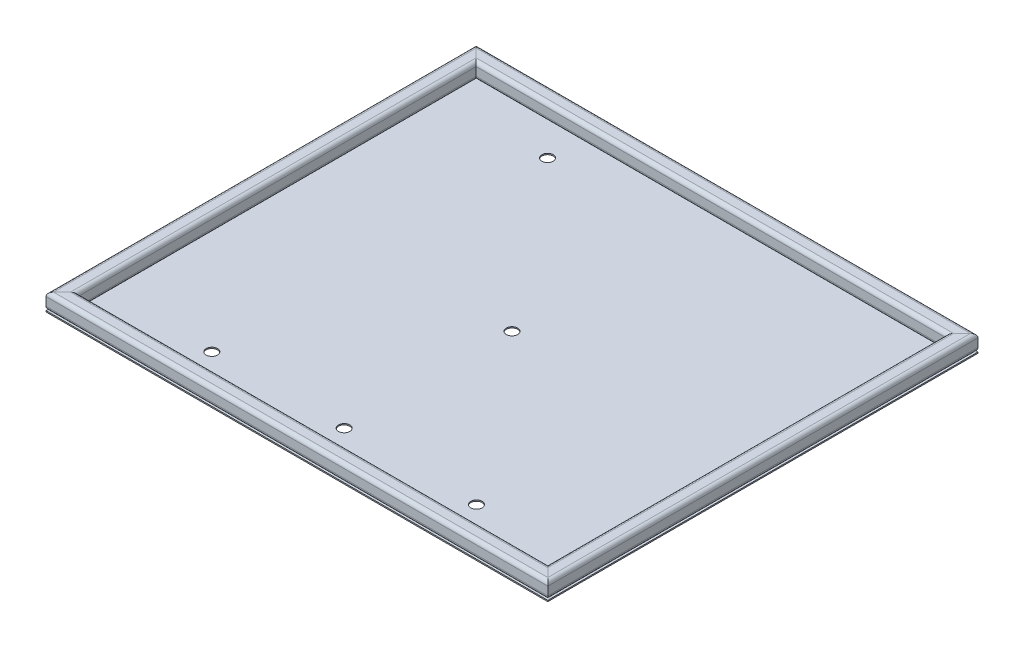
from build123d import *

# Parameters (mm, degrees)
TUBO_CUADRADO_2_X_2_X_0_25_1_DEPTH      = 719.721024484
TUBO_CUADRADO_2_X_2_X_0_25_1_DEPTH_BACK = 36.921024484
TUBO_CUADRADO_2_X_2_X_0_25_1_2_DEPTH    = 870.242048969
TUBO_CUADRADO_2_X_2_X_0_25_1_3_DEPTH    = 756.642048969
TUBO_CUADRADO_2_X_2_X_0_25_1_4_DEPTH    = 870.242048969
CROQUIS3_W                              = 796.4
CROQUIS3_H                              = 682.8
SALIENTE_EXTRUIR1_DEPTH                 = 1.9
CROQUIS6_R                              = 9
CORTAR_EXTRUIR2_DEPTH                   = 10


with BuildPart() as part:
    # Sketch1 → Tubo cuadrado 2 X 2 X 0.25(1) (new, two sides: drawn at the far end of the back side and taken through both)
    with BuildSketch(Plane(origin=(-385.5, 12.7, -341.4), x_dir=(1, 0, 0), z_dir=(0, 0, 1)).offset(-TUBO_CUADRADO_2_X_2_X_0_25_1_DEPTH_BACK)):
        with BuildLine():
            Line((-6.7, -12.7), (6.7, -12.7))
            ThreePointArc((6.7, -12.7), (10.942640687, -10.942640687), (12.7, -6.7))
            Line((12.7, -6.7), (12.7, 6.7))
            ThreePointArc((12.7, 6.7), (10.942640687, 10.942640687), (6.7, 12.7))
            Line((6.7, 12.7), (-6.7, 12.7))
            ThreePointArc((-6.7, 12.7), (-10.942640687, 10.942640687), (-12.7, 6.7))
            Line((-12.7, 6.7), (-12.7, -6.7))
            ThreePointArc((-12.7, -6.7), (-10.942640687, -10.942640687), (-6.7, -12.7))
        make_face()
        with BuildLine():
            Line((-6.7, -9.7), (6.7, -9.7))
            ThreePointArc((6.7, -9.7), (8.821320344, -8.821320344), (9.7, -6.7))
            Line((9.7, -6.7), (9.7, 6.7))
            ThreePointArc((9.7, 6.7), (8.821320344, 8.821320344), (6.7, 9.7))
            Line((6.7, 9.7), (-6.7, 9.7))
            ThreePointArc((-6.7, 9.7), (-8.821320344, 8.821320344), (-9.7, 6.7))
            Line((-9.7, 6.7), (-9.7, -6.7))
            ThreePointArc((-9.7, -6.7), (-8.821320344, -8.821320344), (-6.7, -9.7))
        make_face(mode=Mode.SUBTRACT)
    extrude(amount=TUBO_CUADRADO_2_X_2_X_0_25_1_DEPTH + TUBO_CUADRADO_2_X_2_X_0_25_1_DEPTH_BACK)

    # Tubo cuadrado 2 X 2 X 0.25(1) mitre 1
    split(bisect_by=Plane(origin=(-398.2, 0, -341.4), x_dir=(0, -1, 0), z_dir=(-0.707106781, 0, 0.707106781)), keep=Keep.TOP)

    # Tubo cuadrado 2 X 2 X 0.25(1) mitre 2
    split(bisect_by=Plane(origin=(-398.2, 0, 341.4), x_dir=(0, -1, 0), z_dir=(-0.707106781, 0, -0.707106781)), keep=Keep.TOP)


with BuildPart() as body_2:
    # Sketch1 on segment 2 (carried to segment 2) → Tubo cuadrado 2 X 2 X 0.25_1 2 (new body)
    with BuildSketch(Plane(origin=(-435.121024484, 12.7, 328.7), x_dir=(0, 0, -1), z_dir=(1, 0, 0))):
        with BuildLine():
            Line((-6.7, -12.7), (6.7, -12.7))
            ThreePointArc((6.7, -12.7), (10.942640687, -10.942640687), (12.7, -6.7))
            Line((12.7, -6.7), (12.7, 6.7))
            ThreePointArc((12.7, 6.7), (10.942640687, 10.942640687), (6.7, 12.7))
            Line((6.7, 12.7), (-6.7, 12.7))
            ThreePointArc((-6.7, 12.7), (-10.942640687, 10.942640687), (-12.7, 6.7))
            Line((-12.7, 6.7), (-12.7, -6.7))
            ThreePointArc((-12.7, -6.7), (-10.942640687, -10.942640687), (-6.7, -12.7))
        make_face()
        with BuildLine():
            Line((-6.7, -9.7), (6.7, -9.7))
            ThreePointArc((6.7, -9.7), (8.821320344, -8.821320344), (9.7, -6.7))
            Line((9.7, -6.7), (9.7, 6.7))
            ThreePointArc((9.7, 6.7), (8.821320344, 8.821320344), (6.7, 9.7))
            Line((6.7, 9.7), (-6.7, 9.7))
            ThreePointArc((-6.7, 9.7), (-8.821320344, 8.821320344), (-9.7, 6.7))
            Line((-9.7, 6.7), (-9.7, -6.7))
            ThreePointArc((-9.7, -6.7), (-8.821320344, -8.821320344), (-6.7, -9.7))
        make_face(mode=Mode.SUBTRACT)
    extrude(amount=TUBO_CUADRADO_2_X_2_X_0_25_1_2_DEPTH)

    # Tubo cuadrado 2 X 2 X 0.25_1 2 mitre 1
    split(bisect_by=Plane(origin=(-398.2, 0, 341.4), x_dir=(0, 1, 0), z_dir=(0.707106781, 0, 0.707106781)), keep=Keep.TOP)

    # Tubo cuadrado 2 X 2 X 0.25_1 2 mitre 2
    split(bisect_by=Plane(origin=(398.2, 0, 341.4), x_dir=(0, -1, 0), z_dir=(-0.707106781, 0, 0.707106781)), keep=Keep.TOP)


with BuildPart() as body_3:
    # Sketch1 on segment 3 (carried to segment 3) → Tubo cuadrado 2 X 2 X 0.25_1 3 (new body)
    with BuildSketch(Plane(origin=(385.5, 12.7, 378.321024484), x_dir=(-1, 0, 0), z_dir=(0, 0, -1))):
        with BuildLine():
            Line((-6.7, -12.7), (6.7, -12.7))
            ThreePointArc((6.7, -12.7), (10.942640687, -10.942640687), (12.7, -6.7))
            Line((12.7, -6.7), (12.7, 6.7))
            ThreePointArc((12.7, 6.7), (10.942640687, 10.942640687), (6.7, 12.7))
            Line((6.7, 12.7), (-6.7, 12.7))
            ThreePointArc((-6.7, 12.7), (-10.942640687, 10.942640687), (-12.7, 6.7))
            Line((-12.7, 6.7), (-12.7, -6.7))
            ThreePointArc((-12.7, -6.7), (-10.942640687, -10.942640687), (-6.7, -12.7))
        make_face()
        with BuildLine():
            Line((-6.7, -9.7), (6.7, -9.7))
            ThreePointArc((6.7, -9.7), (8.821320344, -8.821320344), (9.7, -6.7))
            Line((9.7, -6.7), (9.7, 6.7))
            ThreePointArc((9.7, 6.7), (8.821320344, 8.821320344), (6.7, 9.7))
            Line((6.7, 9.7), (-6.7, 9.7))
            ThreePointArc((-6.7, 9.7), (-8.821320344, 8.821320344), (-9.7, 6.7))
            Line((-9.7, 6.7), (-9.7, -6.7))
            ThreePointArc((-9.7, -6.7), (-8.821320344, -8.821320344), (-6.7, -9.7))
        make_face(mode=Mode.SUBTRACT)
    extrude(amount=TUBO_CUADRADO_2_X_2_X_0_25_1_3_DEPTH)

    # Tubo cuadrado 2 X 2 X 0.25_1 3 mitre 1
    split(bisect_by=Plane(origin=(398.2, 0, -341.4), x_dir=(0, 1, 0), z_dir=(0.707106781, 0, 0.707106781)), keep=Keep.TOP)

    # Tubo cuadrado 2 X 2 X 0.25_1 3 mitre 2
    split(bisect_by=Plane(origin=(398.2, 0, 341.4), x_dir=(0, 1, 0), z_dir=(0.707106781, 0, -0.707106781)), keep=Keep.TOP)


with BuildPart() as body_4:
    # Sketch1 on segment 4 (carried to segment 4) → Tubo cuadrado 2 X 2 X 0.25_1 4 (new body)
    with BuildSketch(Plane(origin=(435.121024484, 12.7, -328.7), x_dir=(0, 0, 1), z_dir=(-1, 0, 0))):
        with BuildLine():
            Line((-6.7, -12.7), (6.7, -12.7))
            ThreePointArc((6.7, -12.7), (10.942640687, -10.942640687), (12.7, -6.7))
            Line((12.7, -6.7), (12.7, 6.7))
            ThreePointArc((12.7, 6.7), (10.942640687, 10.942640687), (6.7, 12.7))
            Line((6.7, 12.7), (-6.7, 12.7))
            ThreePointArc((-6.7, 12.7), (-10.942640687, 10.942640687), (-12.7, 6.7))
            Line((-12.7, 6.7), (-12.7, -6.7))
            ThreePointArc((-12.7, -6.7), (-10.942640687, -10.942640687), (-6.7, -12.7))
        make_face()
        with BuildLine():
            Line((-6.7, -9.7), (6.7, -9.7))
            ThreePointArc((6.7, -9.7), (8.821320344, -8.821320344), (9.7, -6.7))
            Line((9.7, -6.7), (9.7, 6.7))
            ThreePointArc((9.7, 6.7), (8.821320344, 8.821320344), (6.7, 9.7))
            Line((6.7, 9.7), (-6.7, 9.7))
            ThreePointArc((-6.7, 9.7), (-8.821320344, 8.821320344), (-9.7, 6.7))
            Line((-9.7, 6.7), (-9.7, -6.7))
            ThreePointArc((-9.7, -6.7), (-8.821320344, -8.821320344), (-6.7, -9.7))
        make_face(mode=Mode.SUBTRACT)
    extrude(amount=TUBO_CUADRADO_2_X_2_X_0_25_1_4_DEPTH)

    # Tubo cuadrado 2 X 2 X 0.25_1 4 mitre 1
    split(bisect_by=Plane(origin=(-398.2, 0, -341.4), x_dir=(0, 1, 0), z_dir=(0.707106781, 0, -0.707106781)), keep=Keep.TOP)

    # Tubo cuadrado 2 X 2 X 0.25_1 4 mitre 2
    split(bisect_by=Plane(origin=(398.2, 0, -341.4), x_dir=(0, -1, 0), z_dir=(-0.707106781, 0, -0.707106781)), keep=Keep.TOP)


with BuildPart() as body_5:
    # Croquis3 → Saliente-Extruir1 (new body)
    with BuildSketch(Plane.XZ):
        Rectangle(CROQUIS3_W, CROQUIS3_H)
    extrude(amount=SALIENTE_EXTRUIR1_DEPTH)

    # Croquis6 → Cortar-Extruir2 (cut)
    with BuildSketch(Plane.XZ.offset(1.9)):
        Circle(CROQUIS6_R)
        with Locations((210, 266.4)):
            Circle(CROQUIS6_R)
        with Locations((0, 266.4)):
            Circle(CROQUIS6_R)
        with Locations((-210, 266.4)):
            Circle(CROQUIS6_R)
        with Locations((-210, -266.4)):
            Circle(CROQUIS6_R)
    extrude(amount=-CORTAR_EXTRUIR2_DEPTH, mode=Mode.SUBTRACT)


solid = Compound([part.part, body_2.part, body_3.part, body_4.part, body_5.part])
